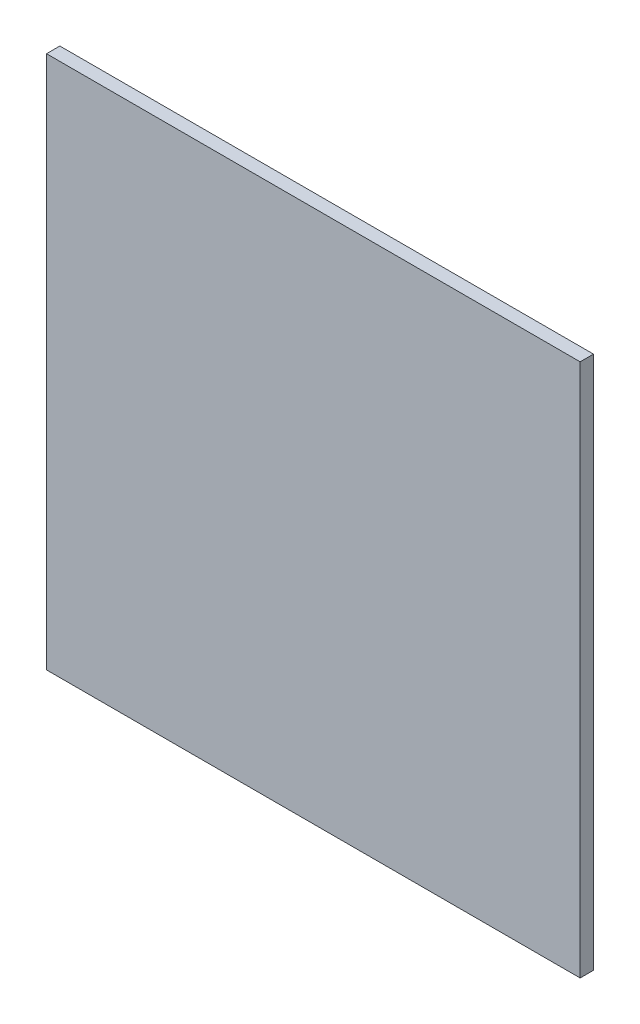
from build123d import *

# Parameters (mm, degrees)
SKETCH1_W           = 100
SKETCH1_H           = 100
BOSS_EXTRUDE1_DEPTH = 2.5


with BuildPart() as part:
    # Sketch1 → Boss-Extrude1 (new body)
    with BuildSketch(Plane.XY):
        with Locations((50, 50)):
            Rectangle(SKETCH1_W, SKETCH1_H)
    extrude(amount=BOSS_EXTRUDE1_DEPTH)


solid = part.part
